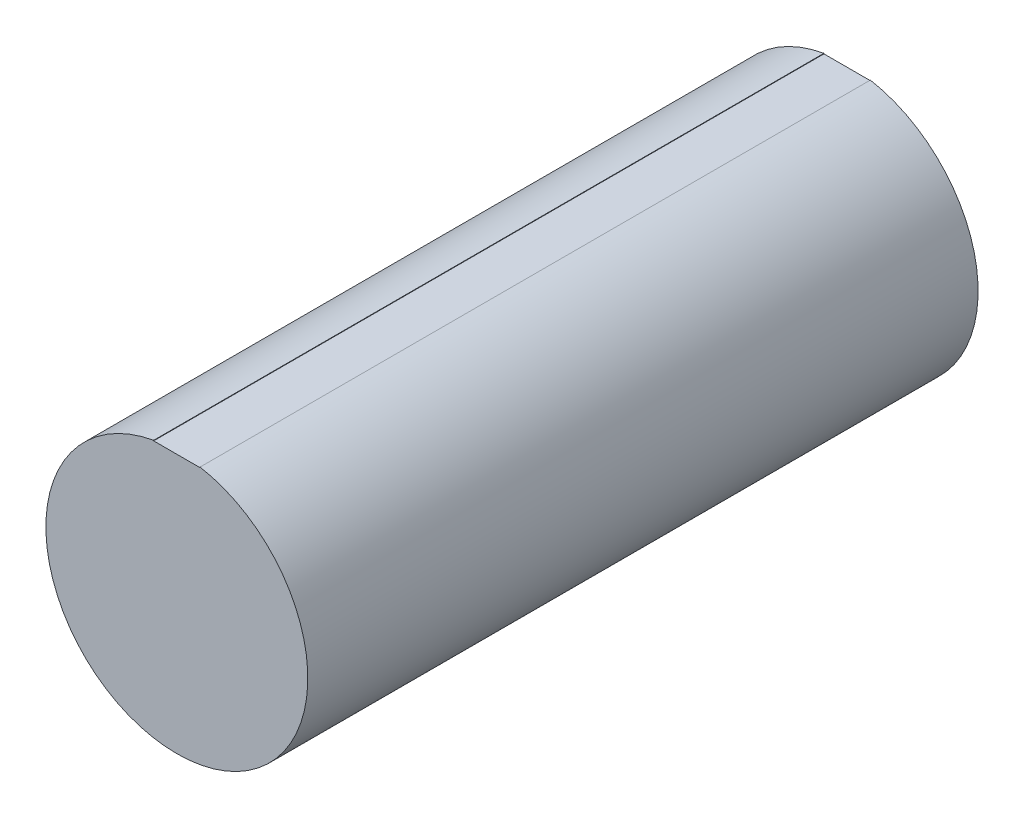
from build123d import *

# Parameters (mm, degrees)
CROQUIS1_R              = 25.4
SALIENTE_EXTRUIR1_DEPTH = 130
CROQUIS2_W              = 9
CROQUIS2_H              = 1
CORTAR_EXTRUIR1_DEPTH   = 130


with BuildPart() as part:
    # Croquis1 → Saliente-Extruir1 (new body)
    with BuildSketch(Plane.XY):
        Circle(CROQUIS1_R)
    extrude(amount=SALIENTE_EXTRUIR1_DEPTH)

    # Croquis2 → Cortar-Extruir1 (cut)
    with BuildSketch(Plane.XY.offset(130)):
        with Locations((0, 25.4)):
            Rectangle(CROQUIS2_W, CROQUIS2_H)
    extrude(amount=-CORTAR_EXTRUIR1_DEPTH, mode=Mode.SUBTRACT)


solid = part.part
